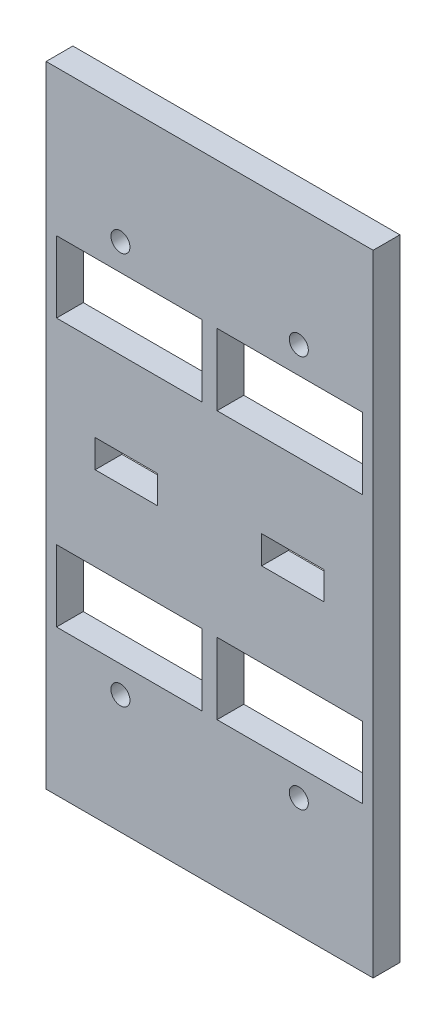
from build123d import *

# Parameters (mm, degrees)
SKETCH1_W           = 55
SKETCH1_H           = 106
SKETCH1_W_2         = 24.5
SKETCH1_H_2         = 12
BOSS_EXTRUDE1_DEPTH = 4.5
SKETCH2_R           = 1.6
CUT_EXTRUDE1_DEPTH  = 60.879044749
SKETCH3_W           = 10.5
SKETCH3_H           = 4.7
CUT_EXTRUDE2_DEPTH  = 60.879044749


with BuildPart() as part:
    # Sketch1 → Boss-Extrude1 (new body)
    with BuildSketch(Plane.XY):
        Rectangle(SKETCH1_W, SKETCH1_H)
        with Locations((-13.5, 22.5)):
            Rectangle(SKETCH1_W_2, SKETCH1_H_2, mode=Mode.SUBTRACT)
        with Locations((13.5, 22.5)):
            Rectangle(SKETCH1_W_2, SKETCH1_H_2, mode=Mode.SUBTRACT)
        with Locations((13.5, -22.5)):
            Rectangle(SKETCH1_W_2, SKETCH1_H_2, mode=Mode.SUBTRACT)
        with Locations((-13.5, -22.5)):
            Rectangle(SKETCH1_W_2, SKETCH1_H_2, mode=Mode.SUBTRACT)
    extrude(amount=BOSS_EXTRUDE1_DEPTH)

    # Sketch2 → Cut-Extrude1 (cut, through all)
    with BuildSketch(Plane.XY.offset(4.5)):
        with Locations((-15, 33)):
            Circle(SKETCH2_R)
        with Locations(Location((15, 33, 0), (0, 0, 180))):
            Circle(SKETCH2_R)
        with Locations((15, -33)):
            Circle(SKETCH2_R)
        with Locations(Location((-15, -33, 0), (0, 0, 180))):
            Circle(SKETCH2_R)
    extrude(amount=-CUT_EXTRUDE1_DEPTH, mode=Mode.SUBTRACT)

    # Sketch3 → Cut-Extrude2 (cut, through all)
    with BuildSketch(Plane.XY.offset(4.5)):
        with Locations((-14, 0)):
            Rectangle(SKETCH3_W, SKETCH3_H)
        with Locations((14, 0)):
            Rectangle(SKETCH3_W, SKETCH3_H)
    extrude(amount=-CUT_EXTRUDE2_DEPTH, mode=Mode.SUBTRACT)


solid = part.part
